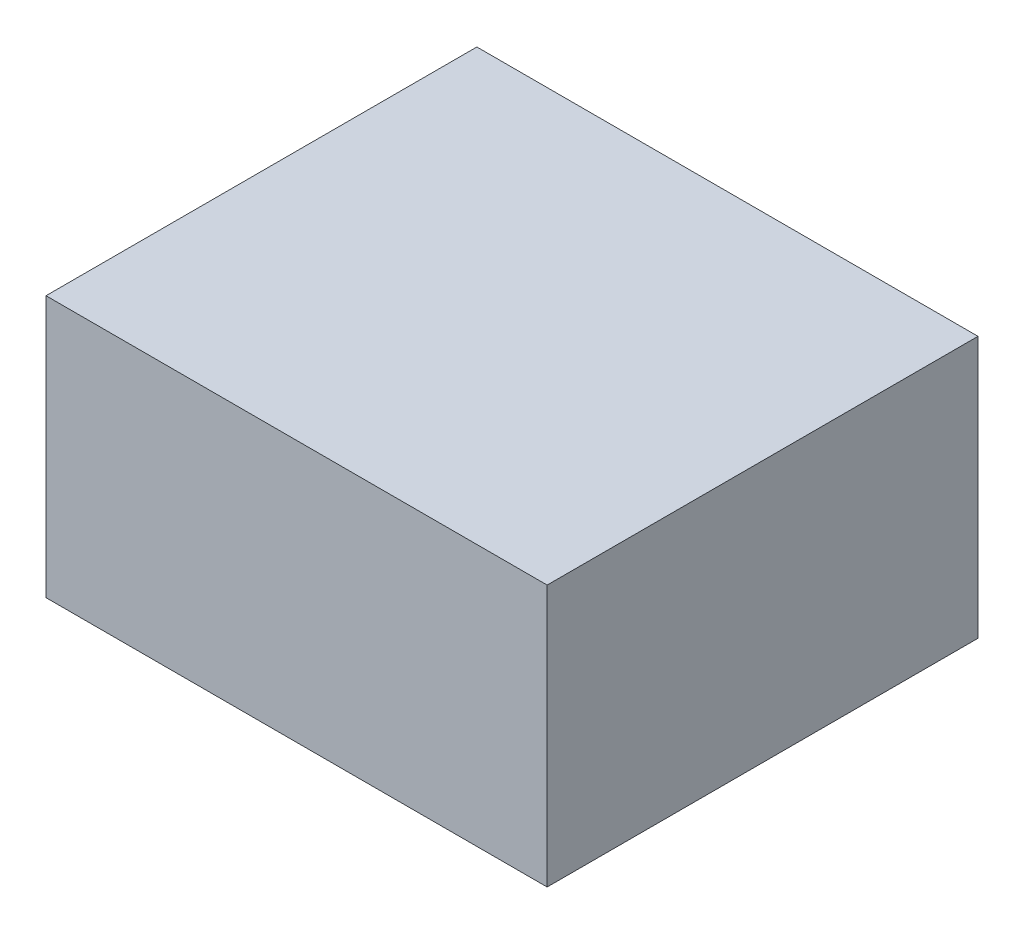
from build123d import *

# Parameters (mm, degrees)
SKETCH1_W               = 13.97
SKETCH1_H               = 7.2900032
COMPONENT_OUTLINE_DEPTH = 12.010009


with BuildPart() as part:
    # Sketch1 → Component_Outline (new body)
    with BuildSketch(Plane.XY):
        with Locations((5.2578, -0.1649984)):
            Rectangle(SKETCH1_W, SKETCH1_H)
    extrude(amount=COMPONENT_OUTLINE_DEPTH)


solid = part.part
